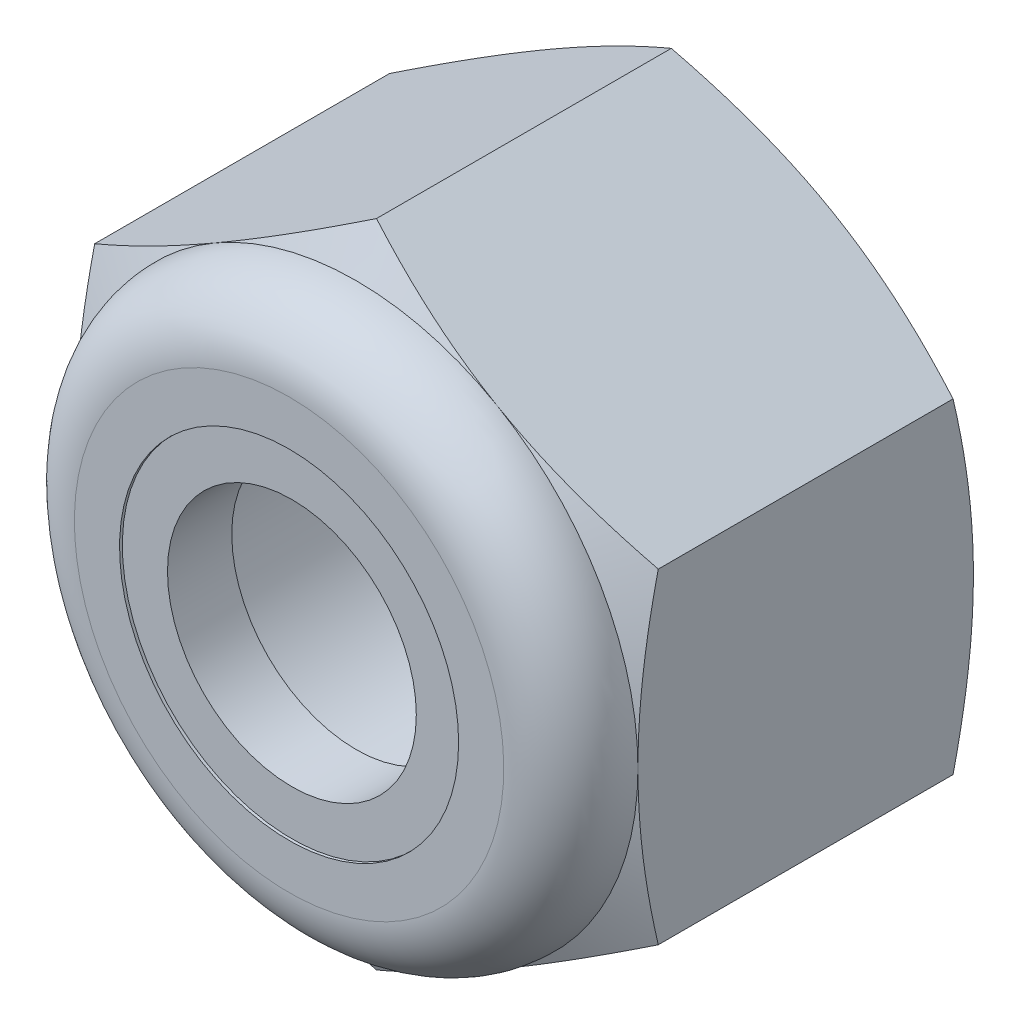
from build123d import *

# Parameters (mm, degrees)
SKETCH3_R           = 2
BOSS_EXTRUDE1_DEPTH = 2.5


with BuildPart() as part:
    # Sketch3 → Boss-Extrude1 (new, symmetric)
    with BuildSketch(Plane.XY):
        Polygon((0, -4.041451884), (3.5, -2.020725942), (3.5, 2.020725942), (0, 4.041451884), (-3.5, 2.020725942), (-3.5, -2.020725942), align=None)
        Circle(SKETCH3_R, mode=Mode.SUBTRACT)
    extrude(amount=BOSS_EXTRUDE1_DEPTH, both=True)

    # Sketch4 → Cut-Revolve1 (revolve, cut)
    with BuildSketch(Plane(origin=(0, 0, 0), x_dir=(0, 0, -1), z_dir=(1, 0, 0))):
        with BuildLine():
            Line((3.77, 5.311451884), (-3.77, 5.311451884))
            Line((-3.77, 5.311451884), (-3.77, 2.666666667))
            Line((-3.77, 2.666666667), (-2.5, 2.666666667))
            ThreePointArc((-2.5, 2.666666667), (-2.255922318, 3.255922318), (-1.666666667, 3.5))
            Line((-1.666666667, 3.5), (-1.414183506, 4.041451884))
            Line((-1.414183506, 4.041451884), (2.24751684, 4.041451884))
            Line((2.24751684, 4.041451884), (2.5, 3.5))
            Line((2.5, 3.5), (2.5, 0))
            Line((2.5, 0), (3.77, 0))
            Line((3.77, 0), (3.77, 5.311451884))
        make_face()
        with BuildLine():
            Line((-3.77, 2.106001665), (-3.77, 0))
            Line((-3.77, 0), (-1.666666667, 0))
            Line((-1.666666667, 0), (-1.666666667, 3.465))
            ThreePointArc((-1.666666667, 3.465), (-2.23117358, 3.23117358), (-2.465, 2.666666667))
            Line((-2.465, 2.666666667), (-2.465, 2.106001665))
            Line((-2.465, 2.106001665), (-3.77, 2.106001665))
        make_face()
    revolve(axis=Axis((0, 0, -2.5), (0, 0, 1)), mode=Mode.SUBTRACT)


with BuildPart() as body_2:
    # Sketch5 → Revolve1 (revolve)
    with BuildSketch(Plane(origin=(0, 0, 0), x_dir=(0, 0, -1), z_dir=(1, 0, 0))):
        with BuildLine():
            Line((-2.465, 2.666666667), (-2.465, 1.545336663))
            Line((-2.465, 1.545336663), (-1.666666667, 1.545336663))
            Line((-1.666666667, 1.545336663), (-1.666666667, 3.465))
            ThreePointArc((-1.666666667, 3.465), (-2.23117358, 3.23117358), (-2.465, 2.666666667))
        make_face()
    revolve(axis=Axis((0, 0, -2.5), (0, 0, 1)))


solid = Compound([part.part, body_2.part])
